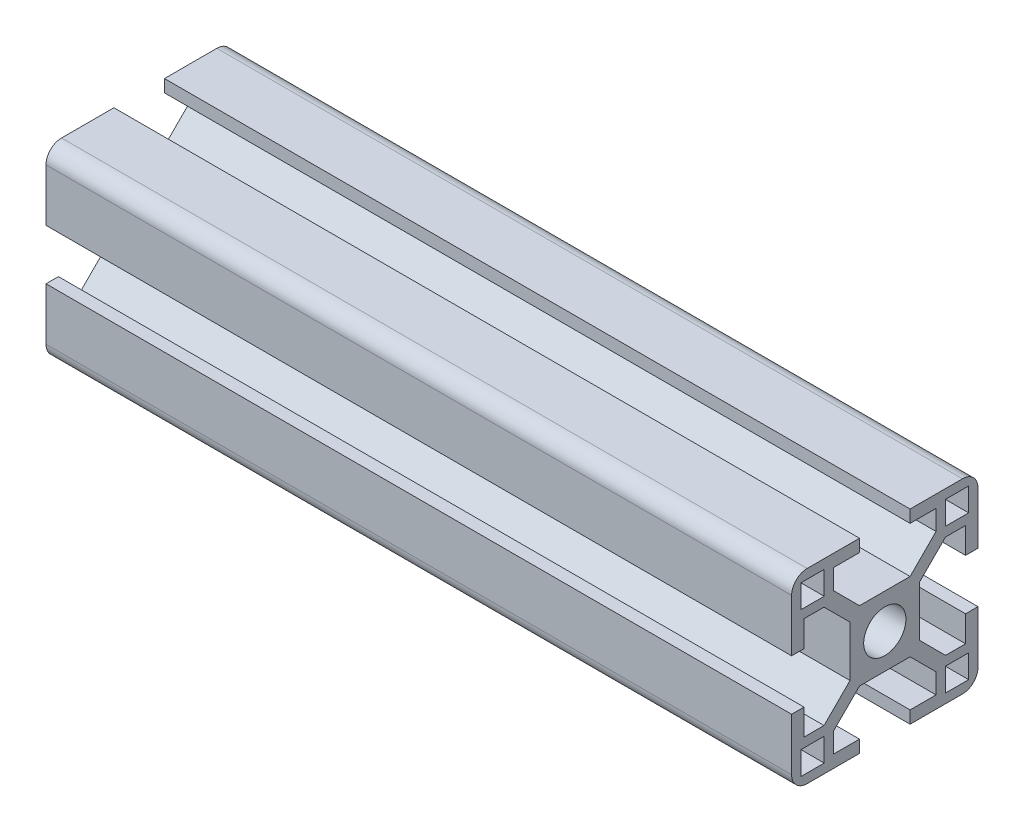
from build123d import *

# Parameters (mm, degrees)
SKETCH11_R                     = 3.4
SKETCH11_W                     = 3.75
SKETCH11_H                     = 3.75
T_SLOT_PROFILES_3030_2_1_DEPTH = 120


with BuildPart() as part:
    # Sketch11 → T-slot profiles 3030_2(1) (new body)
    with BuildSketch(Plane(origin=(0, 0, 0), x_dir=(0, 0, -1), z_dir=(1, 0, 0))):
        with BuildLine():
            Line((-4.07, 5.6), (4.07, 5.6))
            Line((4.07, 5.6), (8.25, 9.78))
            Line((8.25, 9.78), (8.25, 13))
            Line((8.25, 13), (4.07, 13))
            Line((4.07, 13), (4.07, 15))
            Line((4.07, 15), (12.5, 15))
            ThreePointArc((12.5, 15), (14.267766953, 14.267766953), (15, 12.5))
            Line((15, 12.5), (15, 4.07))
            Line((15, 4.07), (13, 4.07))
            Line((13, 4.07), (13, 8.25))
            Line((13, 8.25), (9.78, 8.25))
            Line((9.78, 8.25), (5.6, 4.07))
            Line((5.6, 4.07), (5.6, -4.07))
            Line((5.6, -4.07), (9.78, -8.25))
            Line((9.78, -8.25), (13, -8.25))
            Line((13, -8.25), (13, -4.07))
            Line((13, -4.07), (15, -4.07))
            Line((15, -4.07), (15, -12.5))
            ThreePointArc((15, -12.5), (14.267766953, -14.267766953), (12.5, -15))
            Line((12.5, -15), (4.07, -15))
            Line((4.07, -15), (4.07, -13))
            Line((4.07, -13), (8.25, -13))
            Line((8.25, -13), (8.25, -9.78))
            Line((8.25, -9.78), (4.07, -5.6))
            Line((4.07, -5.6), (-4.07, -5.6))
            Line((-4.07, -5.6), (-8.25, -9.78))
            Line((-8.25, -9.78), (-8.25, -13))
            Line((-8.25, -13), (-4.07, -13))
            Line((-4.07, -13), (-4.07, -15))
            Line((-4.07, -15), (-12.5, -15))
            ThreePointArc((-12.5, -15), (-14.267766953, -14.267766953), (-15, -12.5))
            Line((-15, -12.5), (-15, -4.07))
            Line((-15, -4.07), (-13, -4.07))
            Line((-13, -4.07), (-13, -8.25))
            Line((-13, -8.25), (-9.78, -8.25))
            Line((-9.78, -8.25), (-5.6, -4.07))
            Line((-5.6, -4.07), (-5.6, 4.07))
            Line((-5.6, 4.07), (-9.78, 8.25))
            Line((-9.78, 8.25), (-13, 8.25))
            Line((-13, 8.25), (-13, 4.07))
            Line((-13, 4.07), (-15, 4.07))
            Line((-15, 4.07), (-15, 12.5))
            ThreePointArc((-15, 12.5), (-14.267766953, 14.267766953), (-12.5, 15))
            Line((-12.5, 15), (-4.07, 15))
            Line((-4.07, 15), (-4.07, 13))
            Line((-4.07, 13), (-8.25, 13))
            Line((-8.25, 13), (-8.25, 9.78))
            Line((-8.25, 9.78), (-4.07, 5.6))
        make_face()
        Circle(SKETCH11_R, mode=Mode.SUBTRACT)
        with Locations((11.625, 11.625)):
            Rectangle(SKETCH11_W, SKETCH11_H, mode=Mode.SUBTRACT)
        with Locations((11.625, -11.625)):
            Rectangle(SKETCH11_W, SKETCH11_H, mode=Mode.SUBTRACT)
        with Locations((-11.625, 11.625)):
            Rectangle(SKETCH11_W, SKETCH11_H, mode=Mode.SUBTRACT)
        with Locations((-11.625, -11.625)):
            Rectangle(SKETCH11_W, SKETCH11_H, mode=Mode.SUBTRACT)
    extrude(amount=T_SLOT_PROFILES_3030_2_1_DEPTH)


solid = part.part
